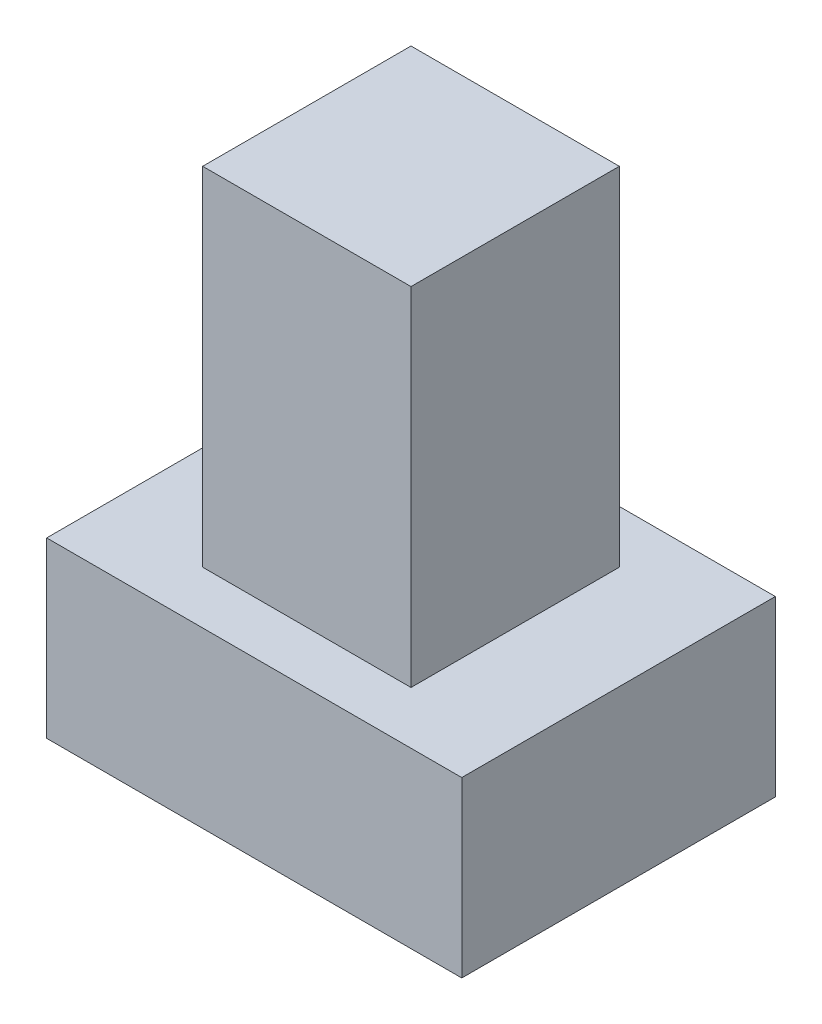
from build123d import *

# Parameters (mm, degrees)
SKETCH1_W           = 11.954436121
SKETCH1_H           = 9.030813176
BOSS_EXTRUDE1_DEPTH = 5
SKETCH7_W           = 6
SKETCH7_H           = 6
BOSS_EXTRUDE2_DEPTH = 10


with BuildPart() as part:
    # Sketch1 → Boss-Extrude1 (new body)
    with BuildSketch(Plane(origin=(0, 0, 0), x_dir=(1, 0, 0), z_dir=(0, 1, 0))):
        with Locations((5.977218061, 4.515406588)):
            Rectangle(SKETCH1_W, SKETCH1_H)
    extrude(amount=BOSS_EXTRUDE1_DEPTH)

    # Sketch7 → Boss-Extrude2 (add)
    with BuildSketch(Plane(origin=(0, 5, 0), x_dir=(1, 0, 0), z_dir=(0, 1, 0))):
        with Locations((5.97721806, 4.515406588)):
            Rectangle(SKETCH7_W, SKETCH7_H)
    extrude(amount=BOSS_EXTRUDE2_DEPTH)


solid = part.part
